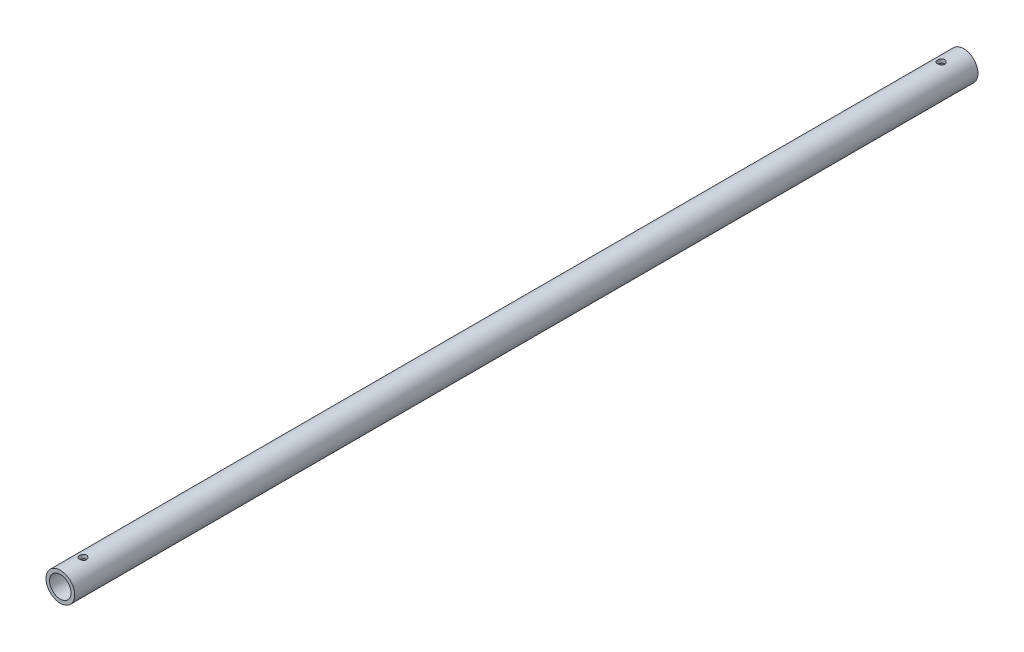
from build123d import *

# Parameters (mm, degrees)
SKETCH1_R               = 6.35
SKETCH1_R_2             = 4.75
BOSS_EXTRUDE1_DEPTH     = 400
CUT_EXTRUDE1_DEPTH      = 400
CUT_EXTRUDE1_DEPTH_BACK = 400
SKETCH2_R               = 1.6


with BuildPart() as part:
    # Sketch1 → Boss-Extrude1 (new body)
    with BuildSketch(Plane.XY):
        Circle(SKETCH1_R)
        Circle(SKETCH1_R_2, mode=Mode.SUBTRACT)
    extrude(amount=BOSS_EXTRUDE1_DEPTH)

    # Sketch2 → Cut-Extrude1 (cut, two sides: drawn at the far end of the back side and taken through both)
    with BuildSketch(Plane(origin=(0, 0, 0), x_dir=(1, 0, 0), z_dir=(0, 1, 0)).offset(-CUT_EXTRUDE1_DEPTH_BACK)):
        with Locations((0, -10)):
            Circle(SKETCH2_R)
        with Locations((0, -390)):
            Circle(SKETCH2_R)
    extrude(amount=CUT_EXTRUDE1_DEPTH + CUT_EXTRUDE1_DEPTH_BACK, mode=Mode.SUBTRACT)


solid = part.part
